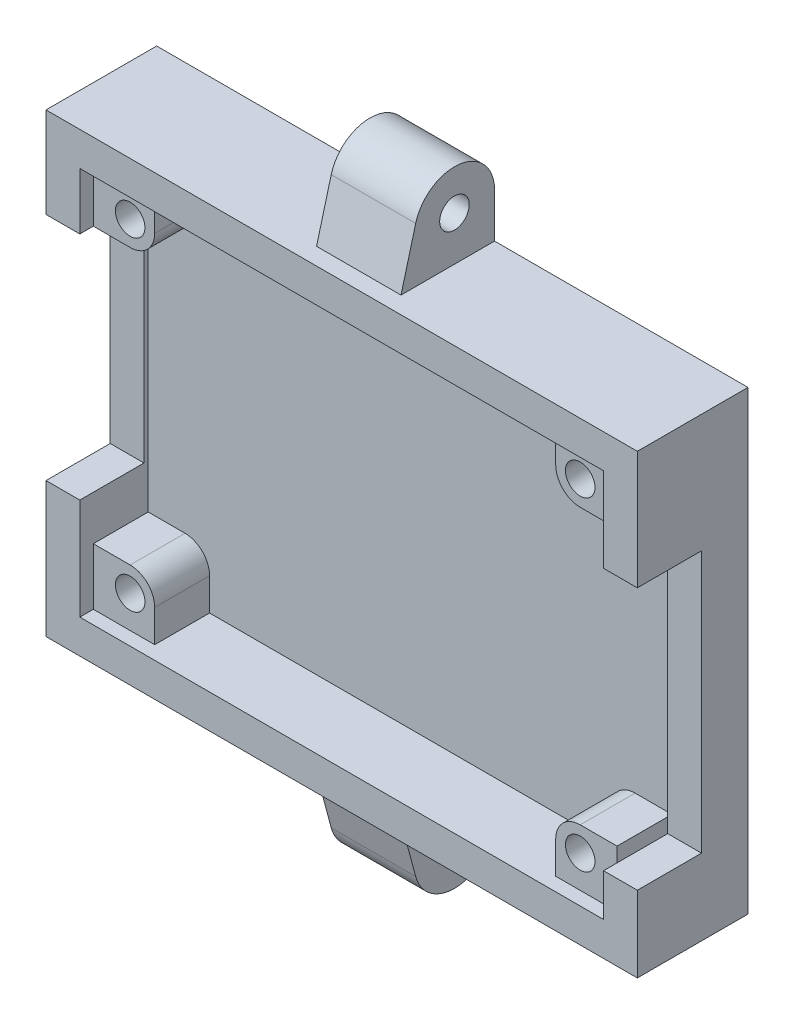
from build123d import *

# Parameters (mm, degrees)
SKETCH1_W           = 62
SKETCH1_H           = 46
SKETCH1_R           = 1.75
BOSS_EXTRUDE1_DEPTH = 5
SKETCH1_3_W         = 70
SKETCH1_3_H         = 54
SKETCH1_3_W_2       = 62
SKETCH1_3_H_2       = 46
BOSS_EXTRUDE2_DEPTH = 13.1
SKETCH2_W           = 12.7
SKETCH2_H           = 4
CUT_EXTRUDE1_DEPTH  = 4
SKETCH3_R           = 1.75
BOSS_EXTRUDE3_DEPTH = 6.5
SKETCH4_W           = 4
SKETCH4_H           = 27.275016295
SKETCH4_H_2         = 31
CUT_EXTRUDE2_DEPTH  = 7.6
SKETCH5_R           = 1.75
BOSS_EXTRUDE4_DEPTH = 5


with BuildPart() as part:
    # Sketch1 → Boss-Extrude1 (new body)
    with BuildSketch(Plane.XY):
        Rectangle(SKETCH1_W, SKETCH1_H)
        with Locations((26.638347595, -19.175016295)):
            Circle(SKETCH1_R, mode=Mode.SUBTRACT)
        with Locations((26.638347595, 19.175016295)):
            Circle(SKETCH1_R, mode=Mode.SUBTRACT)
        with Locations((-26.638347595, 19.175016295)):
            Circle(SKETCH1_R, mode=Mode.SUBTRACT)
        with Locations((-26.638347595, -19.175016295)):
            Circle(SKETCH1_R, mode=Mode.SUBTRACT)
    extrude(amount=BOSS_EXTRUDE1_DEPTH)

    # Sketch1<3> → Boss-Extrude2 (add)
    with BuildSketch(Plane.XY):
        Rectangle(SKETCH1_3_W, SKETCH1_3_H)
        Rectangle(SKETCH1_3_W_2, SKETCH1_3_H_2, mode=Mode.SUBTRACT)
    extrude(amount=BOSS_EXTRUDE2_DEPTH)

    # Sketch2 → Cut-Extrude1 (cut)
    with BuildSketch(Plane.XY.offset(5)):
        with Locations((-3.48328221, 21)):
            Rectangle(SKETCH2_W, SKETCH2_H)
    extrude(amount=-CUT_EXTRUDE1_DEPTH, mode=Mode.SUBTRACT)

    # Sketch3 → Boss-Extrude3 (add)
    # profile 1 of 4: a face of its own
    with BuildSketch(Plane.XY.offset(5)):
        with BuildLine():
            Line((-23.738347595, 19.175016295), (-23.738347595, 23))
            Line((-23.738347595, 23), (-31, 23))
            Line((-31, 23), (-31, 16.275016295))
            Line((-31, 16.275016295), (-26.638347595, 16.275016295))
            ThreePointArc((-26.638347595, 16.275016295), (-24.58773793, 17.12440663), (-23.738347595, 19.175016295))
        make_face()
        with Locations((-26.638347595, 19.175016295)):
            Circle(SKETCH3_R, mode=Mode.SUBTRACT)
    # profile 2 of 4: a face of its own
    with BuildSketch(Plane.XY.offset(5)):
        with BuildLine():
            Line((-31, -16.275016295), (-26.638347595, -16.275016295))
            ThreePointArc((-26.638347595, -16.275016295), (-24.58773793, -17.12440663), (-23.738347595, -19.175016295))
            Line((-23.738347595, -19.175016295), (-23.738347595, -23))
            Line((-23.738347595, -23), (-31, -23))
            Line((-31, -23), (-31, -16.275016295))
        make_face()
        with Locations((-26.638347595, -19.175016295)):
            Circle(SKETCH3_R, mode=Mode.SUBTRACT)
    # profile 3 of 4: a face of its own
    with BuildSketch(Plane.XY.offset(5)):
        with BuildLine():
            Line((31, -23), (31, -16.275016295))
            Line((31, -16.275016295), (26.638347595, -16.275016295))
            ThreePointArc((26.638347595, -16.275016295), (24.58773793, -17.12440663), (23.738347595, -19.175016295))
            Line((23.738347595, -19.175016295), (23.738347595, -23))
            Line((23.738347595, -23), (31, -23))
        make_face()
        with Locations((26.638347595, -19.175016295)):
            Circle(SKETCH3_R, mode=Mode.SUBTRACT)
    # profile 4 of 4: a face of its own
    with BuildSketch(Plane.XY.offset(5)):
        with BuildLine():
            Line((31, 16.275016295), (26.638347595, 16.275016295))
            ThreePointArc((26.638347595, 16.275016295), (24.58773793, 17.12440663), (23.738347595, 19.175016295))
            Line((23.738347595, 19.175016295), (23.738347595, 23))
            Line((23.738347595, 23), (31, 23))
            Line((31, 23), (31, 16.275016295))
        make_face()
        with Locations((26.638347595, 19.175016295)):
            Circle(SKETCH3_R, mode=Mode.SUBTRACT)
    extrude(amount=BOSS_EXTRUDE3_DEPTH)

    # Sketch4 → Cut-Extrude2 (cut)
    with BuildSketch(Plane.XY.offset(13.1)):
        with Locations((-33, 2.637508148)):
            Rectangle(SKETCH4_W, SKETCH4_H)
        with Locations((33, -2.5)):
            Rectangle(SKETCH4_W, SKETCH4_H_2)
    extrude(amount=-CUT_EXTRUDE2_DEPTH, mode=Mode.SUBTRACT)

    # Sketch5 → Boss-Extrude4 (add, symmetric)
    # profile 1 of 2: a face of its own
    with BuildSketch(Plane(origin=(0, 0, 0), x_dir=(0, 0, -1), z_dir=(1, 0, 0))):
        with BuildLine():
            Line((-11.074295117, 27), (-9.338147675, 33.479390464))
            ThreePointArc((-9.338147675, 33.479390464), (-4.130000587, 36.959363092), (0, 32.25))
            Line((0, 32.25), (0, 27))
            Line((0, 27), (-11.074295117, 27))
        make_face()
        with Locations((-4.75, 32.25)):
            Circle(SKETCH5_R, mode=Mode.SUBTRACT)
    # profile 2 of 2: a face of its own
    with BuildSketch(Plane(origin=(0, 0, 0), x_dir=(0, 0, -1), z_dir=(1, 0, 0))):
        with BuildLine():
            Line((0, -32.25), (0, -27))
            Line((0, -27), (-11.074295117, -27))
            Line((-11.074295117, -27), (-9.338147675, -33.479390464))
            ThreePointArc((-9.338147675, -33.479390464), (-4.130000587, -36.959363092), (0, -32.25))
        make_face()
        with Locations(Location((-4.75, -32.25, 0), (0, 0, 180))):
            Circle(SKETCH5_R, mode=Mode.SUBTRACT)
    extrude(amount=BOSS_EXTRUDE4_DEPTH, both=True)


solid = part.part
